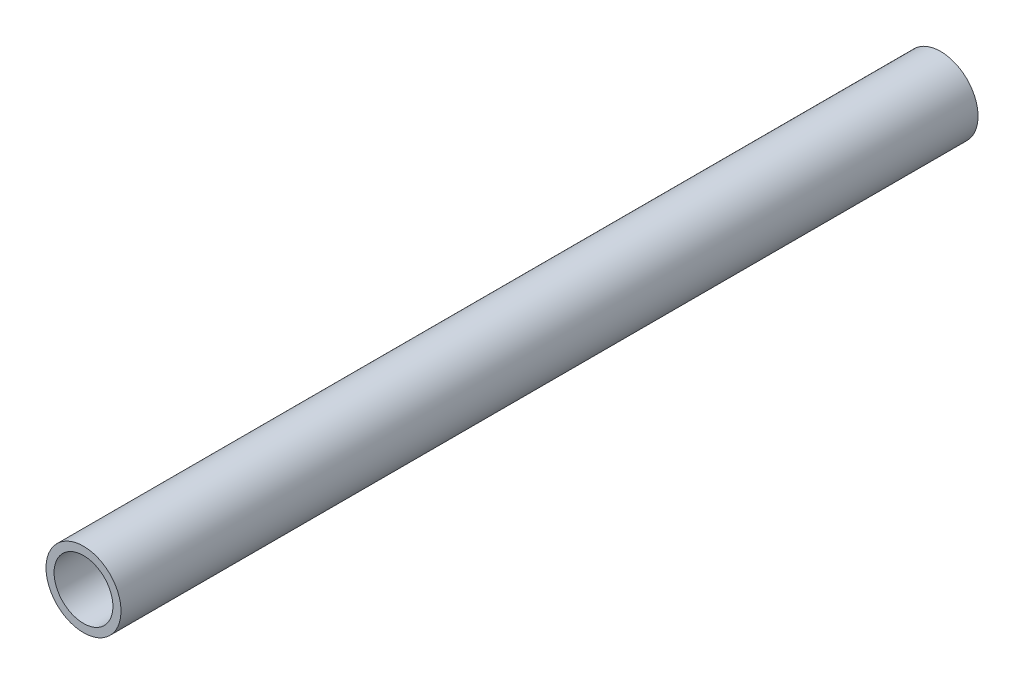
from build123d import *

# Parameters (mm, degrees)
SKETCH1_R           = 13.335
SKETCH1_R_2         = 10.4648
BOSS_EXTRUDE1_DEPTH = 304.8


with BuildPart() as part:
    # Sketch1 → Boss-Extrude1 (new body)
    with BuildSketch(Plane.XY):
        with Locations(Location((0, 0, 0), (0, 0, 180))):
            Circle(SKETCH1_R)
        with Locations(Location((0, 0, 0), (0, 0, 180))):
            Circle(SKETCH1_R_2, mode=Mode.SUBTRACT)
    extrude(amount=BOSS_EXTRUDE1_DEPTH)


solid = part.part
